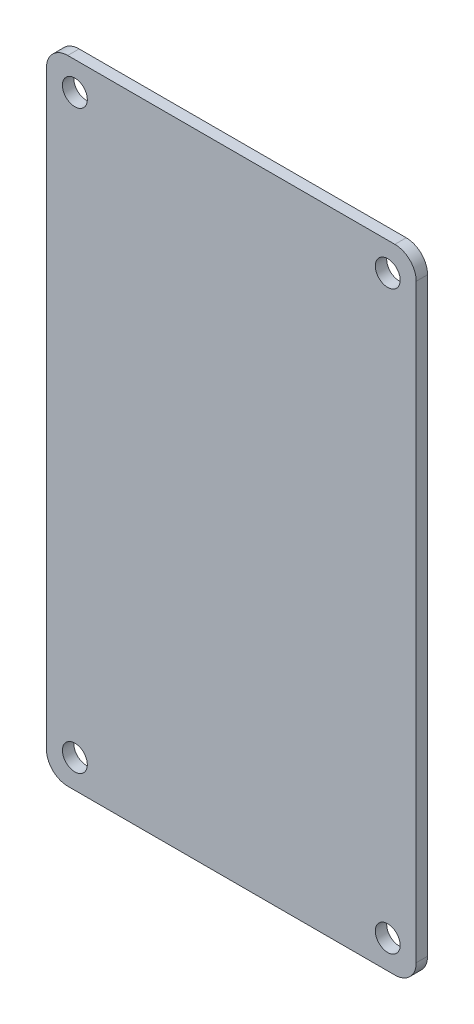
from build123d import *

# Parameters (mm, degrees)
ESQUISSE1_W                  = 52
ESQUISSE1_H                  = 89
BOSS_EXTRU_1_DEPTH           = 1.6
ENL_V_MAT_EXTRU_1_DEPTH      = 104.090057717
ENL_V_MAT_EXTRU_1_DEPTH_BACK = 104.090057717
ESQUISSE2_R                  = 1.75
CONG_1_R                     = 3


with BuildPart() as part:
    # Esquisse1 → Boss.-Extru.1 (new body)
    with BuildSketch(Plane.XY):
        with Locations((26, 44.5)):
            Rectangle(ESQUISSE1_W, ESQUISSE1_H)
    extrude(amount=BOSS_EXTRU_1_DEPTH)

    # Esquisse2 → Enlèv. mat.-Extru.1 (cut, two sides: drawn at the far end of the back side and taken through both)
    with BuildSketch(Plane.XY.offset(1.6).offset(-ENL_V_MAT_EXTRU_1_DEPTH_BACK)):
        with Locations((48, 85)):
            Circle(ESQUISSE2_R)
        with Locations(Location((48, 4, 0), (0, 0, 180))):
            Circle(ESQUISSE2_R)
        with Locations((4, 4)):
            Circle(ESQUISSE2_R)
        with Locations(Location((4, 85, 0), (0, 0, 180))):
            Circle(ESQUISSE2_R)
    extrude(amount=ENL_V_MAT_EXTRU_1_DEPTH + ENL_V_MAT_EXTRU_1_DEPTH_BACK, mode=Mode.SUBTRACT)

    # Congé1
    cong_1_edges = [part.edges().sort_by_distance(p)[0] for p in [
        (0, 89, 0.8),
        (52, 89, 0.8),
        (52, 0, 0.8),
        (0, 0, 0.8),
    ]]
    fillet(cong_1_edges, radius=CONG_1_R)


solid = part.part
